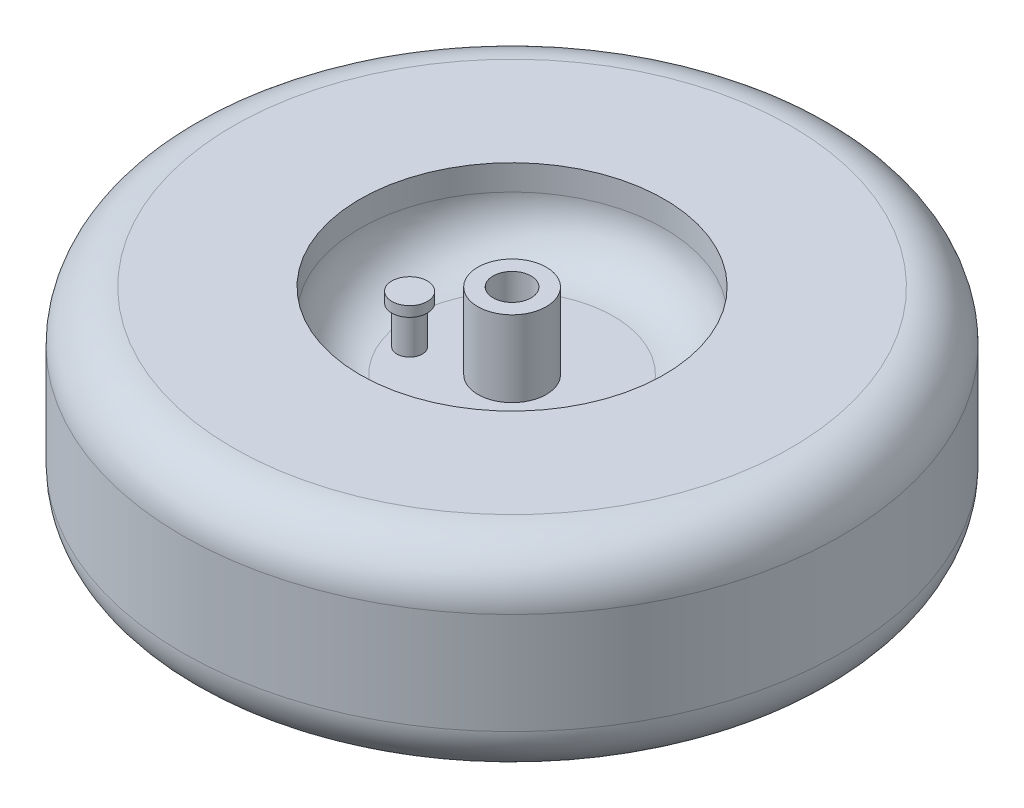
from build123d import *

# Parameters (mm, degrees)
SKETCH1_R           = 165.1
BOSS_EXTRUDE2_DEPTH = 101.6
SKETCH2_R           = 76.2
CUT_EXTRUDE1_DEPTH  = 38.1
FILLET3_R           = 25.4
FILLET4_R           = 25.4
CUT_EXTRUDE2_START  = -38.1
SKETCH3_R           = 76.2
CUT_EXTRUDE2_DEPTH  = 38.1
FILLET5_R           = 25.4
FILLET6_R           = 25.4
SKETCH4_R           = 17.145
BOSS_EXTRUDE3_DEPTH = 38.1
BOSS_EXTRUDE4_START = 38.1
SKETCH5_R           = 17.145
BOSS_EXTRUDE4_DEPTH = 38.1
SKETCH6_R           = 9.525
CUT_EXTRUDE3_DEPTH  = 255.634208358
SKETCH7_R           = 6.35
BOSS_EXTRUDE5_DEPTH = 19.05
SKETCH8_R           = 8.89
BOSS_EXTRUDE6_DEPTH = 5.08


with BuildPart() as part:
    # Sketch1 → Boss-Extrude2 (new body)
    with BuildSketch(Plane(origin=(0, 0, 0), x_dir=(1, 0, 0), z_dir=(0, 1, 0))):
        with Locations(Location((0, 0, 0), (0, 0, 270))):
            Circle(SKETCH1_R)
    extrude(amount=BOSS_EXTRUDE2_DEPTH)

    # Sketch2 → Cut-Extrude1 (cut)
    with BuildSketch(Plane(origin=(0, 101.6, 0), x_dir=(1, 0, 0), z_dir=(0, 1, 0))):
        with Locations(Location((0, 0, 0), (0, 0, 270))):
            Circle(SKETCH2_R)
    extrude(amount=-CUT_EXTRUDE1_DEPTH, mode=Mode.SUBTRACT)

    # Fillet3
    fillet3_edges = [part.edges().sort_by_distance(p)[0] for p in [
        (0, 63.5, -76.2),
    ]]
    fillet(fillet3_edges, radius=FILLET3_R)

    # Fillet4
    fillet4_edges = [part.edges().sort_by_distance(p)[0] for p in [
        (0, 101.6, -165.1),
    ]]
    fillet(fillet4_edges, radius=FILLET4_R)

    # Sketch3 → Cut-Extrude2 (cut)
    with BuildSketch(Plane(origin=(0, 0, 0), x_dir=(-1, 0, 0), z_dir=(0, -1, 0)).offset(CUT_EXTRUDE2_START)):
        with Locations(Location((0, 0, 0), (0, 0, 270))):
            Circle(SKETCH3_R)
    extrude(amount=CUT_EXTRUDE2_DEPTH, mode=Mode.SUBTRACT)

    # Fillet5
    fillet5_edges = [part.edges().sort_by_distance(p)[0] for p in [
        (0, 38.1, -76.2),
    ]]
    fillet(fillet5_edges, radius=FILLET5_R)

    # Fillet6
    fillet6_edges = [part.edges().sort_by_distance(p)[0] for p in [
        (0, 0, -165.1),
    ]]
    fillet(fillet6_edges, radius=FILLET6_R)

    # Sketch4 → Boss-Extrude3 (add)
    with BuildSketch(Plane(origin=(0, 38.1, 0), x_dir=(-1, 0, 0), z_dir=(0, -1, 0))):
        with Locations(Location((0, 0, 0), (0, 0, 270))):
            Circle(SKETCH4_R)
    extrude(amount=BOSS_EXTRUDE3_DEPTH)

    # Sketch5 → Boss-Extrude4 (add)
    with BuildSketch(Plane(origin=(0, 63.5, 0), x_dir=(1, 0, 0), z_dir=(0, 1, 0)).offset(BOSS_EXTRUDE4_START)):
        with Locations(Location((0, 0, 0), (0, 0, 270))):
            Circle(SKETCH5_R)
    extrude(amount=-BOSS_EXTRUDE4_DEPTH)

    # Sketch6 → Cut-Extrude3 (cut, through all)
    with BuildSketch(Plane(origin=(0, 101.6, 0), x_dir=(1, 0, 0), z_dir=(0, 1, 0))):
        with Locations(Location((0, 0, 0), (0, 0, 270))):
            Circle(SKETCH6_R)
    extrude(amount=-CUT_EXTRUDE3_DEPTH, mode=Mode.SUBTRACT)

    # Sketch7 → Boss-Extrude5 (add)
    with BuildSketch(Plane(origin=(0, 63.5, 0), x_dir=(1, 0, 0), z_dir=(0, 1, 0))):
        with Locations(Location((-37.785648207, -13.547919649, 0), (0, 0, 90))):
            Circle(SKETCH7_R)
    extrude(amount=BOSS_EXTRUDE5_DEPTH)

    # Sketch8 → Boss-Extrude6 (add)
    with BuildSketch(Plane(origin=(0, 82.55, 0), x_dir=(1, 0, 0), z_dir=(0, 1, 0))):
        with Locations(Location((-37.785648207, -13.547919649, 0), (0, 0, 270))):
            Circle(SKETCH8_R)
    extrude(amount=BOSS_EXTRUDE6_DEPTH)


solid = part.part
